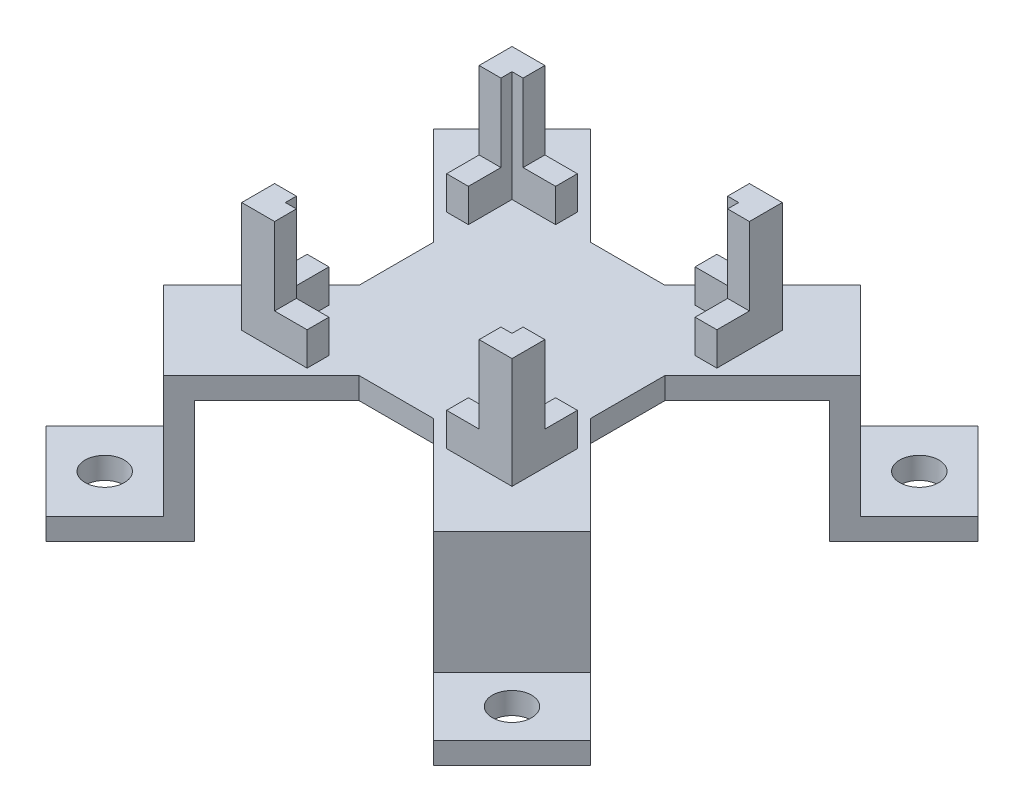
from build123d import *

# Parameters (mm, degrees)
BOSS_EXTRUDE1_DEPTH = 5
BOSS_EXTRUDE2_DEPTH = 7.62
BOSS_EXTRUDE3_DEPTH = 28
SKETCH5_W           = 25.4
SKETCH5_H           = 5
BOSS_EXTRUDE4_DEPTH = 19.05
SKETCH6_W           = 25.4
SKETCH6_H           = 5
BOSS_EXTRUDE5_DEPTH = 19.05
SKETCH7_W           = 25.4
SKETCH7_H           = 5
BOSS_EXTRUDE6_DEPTH = 19.05
SKETCH8_W           = 25.4
SKETCH8_H           = 5
BOSS_EXTRUDE7_DEPTH = 19.05
SKETCH9_R           = 4.5
CUT_EXTRUDE1_DEPTH  = 12.7
BOSS_EXTRUDE8_DEPTH = 25.4


with BuildPart() as part:
    # Sketch2 → Boss-Extrude1 (new body)
    with BuildSketch(Plane(origin=(0, 0, 0), x_dir=(1, 0, 0), z_dir=(0, 1, 0))):
        Polygon((-31, 48.960512242), (-48.960512242, 31), (-26.509871939, 8.549359697), (-26.509871939, -8.549359697), (-48.960512242, -31), (-31, -48.960512242), (-8.549359697, -26.509871939), (8.549359697, -26.509871939), (31, -48.960512242), (48.960512242, -31), (26.509871939, -8.549359697), (26.509871939, 8.549359697), (48.960512242, 31), (31, 48.960512242), (8.549359697, 26.509871939), (-8.549359697, 26.509871939), align=None)
    extrude(amount=BOSS_EXTRUDE1_DEPTH)

    # Sketch3 → Boss-Extrude2 (add)
    with BuildSketch(Plane(origin=(0, 5, 0), x_dir=(-1, 0, 0), z_dir=(0, 1, 0))):
        Polygon((31, 31), (16, 31), (16, 26), (26, 26), (26, 16), (31, 16), align=None)
        Polygon((31, -31), (31, -16), (26, -16), (26, -26), (16, -26), (16, -31), align=None)
        Polygon((-31, 31), (-31, 16), (-26, 16), (-26, 26), (-16, 26), (-16, 31), align=None)
        Polygon((-31, -31), (-16, -31), (-16, -26), (-26, -26), (-26, -16), (-31, -16), align=None)
    extrude(amount=BOSS_EXTRUDE2_DEPTH)

    # Sketch4 → Boss-Extrude3 (add)
    with BuildSketch(Plane(origin=(0, 0, 0), x_dir=(-1, 0, 0), z_dir=(0, -1, 0))):
        Polygon((31, -48.960512242), (48.960512242, -31), (45.424978336, -27.464466094), (27.464466094, -45.424978336), align=None)
        Polygon((48.960512242, 31), (31, 48.960512242), (27.464466094, 45.424978336), (45.424978336, 27.464466094), align=None)
        Polygon((-31, 48.960512242), (-48.960512242, 31), (-45.424978336, 27.464466094), (-27.464466094, 45.424978336), align=None)
        Polygon((-48.960512242, -31), (-31, -48.960512242), (-27.464466094, -45.424978336), (-45.424978336, -27.464466094), align=None)
    extrude(amount=BOSS_EXTRUDE3_DEPTH)

    # Sketch5 → Boss-Extrude4 (add)
    with BuildSketch(Plane(origin=(104.086919113, 0, 24.126406871), x_dir=(0.7071067811865459, 0, 0.7071067811865492), z_dir=(-0.7071067811865492, 0, 0.7071067811865459))):
        with Locations((-90.660512242, -25.5)):
            Rectangle(SKETCH5_W, SKETCH5_H)
    extrude(amount=-BOSS_EXTRUDE4_DEPTH)

    # Sketch6 → Boss-Extrude5 (add)
    with BuildSketch(Plane(origin=(32.44615075, 0, -112.406662992), x_dir=(0.7071067811865465, 0, -0.7071067811865487), z_dir=(0.7071067811865487, 0, 0.7071067811865465))):
        with Locations((-102.426406871, -25.5)):
            Rectangle(SKETCH6_W, SKETCH6_H)
    extrude(amount=-BOSS_EXTRUDE5_DEPTH)

    # Sketch7 → Boss-Extrude6 (add)
    with BuildSketch(Plane(origin=(-39.980256121, 0, 39.980256121), x_dir=(-0.7071067811865459, 0, -0.7071067811865492), z_dir=(0.7071067811865492, 0, -0.7071067811865459))):
        with Locations((0, -25.5)):
            Rectangle(SKETCH7_W, SKETCH7_H)
    extrude(amount=-BOSS_EXTRUDE6_DEPTH)

    # Sketch8 → Boss-Extrude7 (add)
    with BuildSketch(Plane(origin=(39.980256121, 0, 39.980256121), x_dir=(0.7071067811865459, 0, -0.7071067811865492), z_dir=(0.7071067811865492, 0, 0.7071067811865459))):
        with Locations((0, -25.5)):
            Rectangle(SKETCH8_W, SKETCH8_H)
    extrude(amount=BOSS_EXTRUDE7_DEPTH)

    # Sketch9 → Cut-Extrude1 (cut)
    with BuildSketch(Plane(origin=(0, -23, 0), x_dir=(1, 0, 0), z_dir=(0, 1, 0))):
        with Locations((46.715448212, -46.715448212)):
            Circle(SKETCH9_R)
        with Locations((46.715448212, 46.715448212)):
            Circle(SKETCH9_R)
        with Locations((-46.715448212, 46.715448212)):
            Circle(SKETCH9_R)
        with Locations((-46.715448212, -46.715448212)):
            Circle(SKETCH9_R)
    extrude(amount=-CUT_EXTRUDE1_DEPTH, mode=Mode.SUBTRACT)

    # Sketch10 → Boss-Extrude8 (add)
    with BuildSketch(Plane(origin=(0, 5, 0), x_dir=(1, 0, 0), z_dir=(0, 1, 0))):
        Polygon((31, -31), (31, -23.46), (26, -23.46), (26, -26), (23.46, -26), (23.46, -31), align=None)
        Polygon((23.46, 31), (23.46, 26), (26, 26), (26, 23.46), (31, 23.46), (31, 31), align=None)
        Polygon((-31, 31), (-31, 23.46), (-26, 23.46), (-26, 26), (-23.46, 26), (-23.46, 31), align=None)
        Polygon((-23.46, -31), (-23.46, -26), (-26, -26), (-26, -23.46), (-31, -23.46), (-31, -31), align=None)
    extrude(amount=BOSS_EXTRUDE8_DEPTH)


solid = part.part
